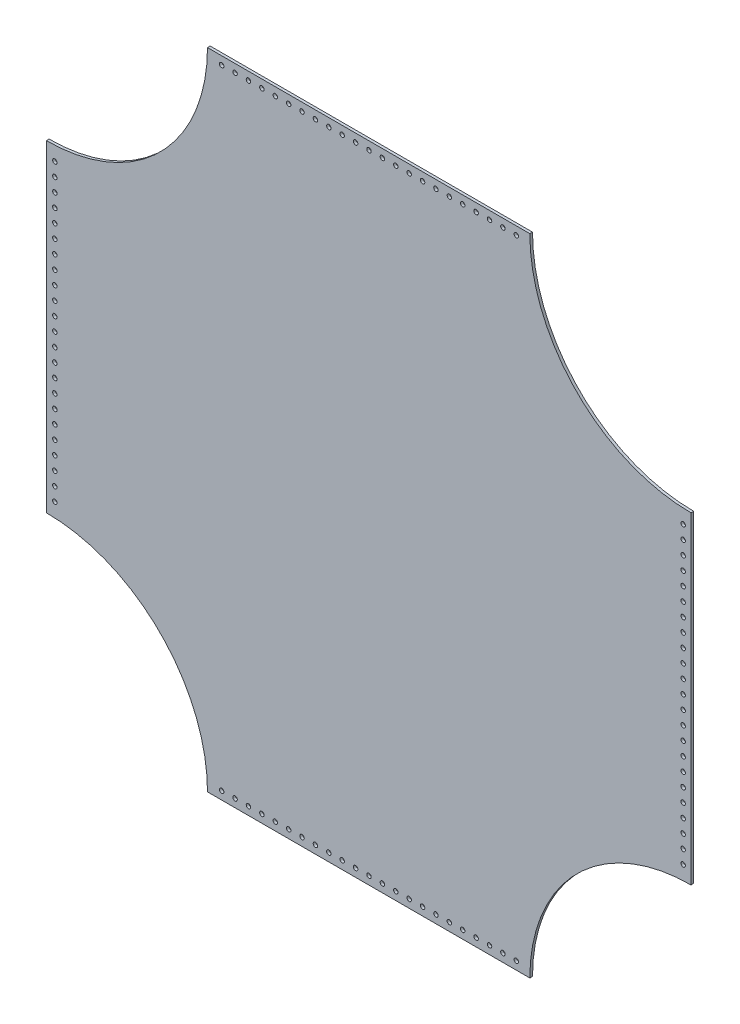
from build123d import *

# Parameters (mm, degrees)
BOSS_EXTRUDE1_DEPTH = 3
SKETCH2_R           = 2.5
CUT_EXTRUDE1_DEPTH  = 3
CIRPATTERN1_COUNT   = 4


with BuildPart() as part:
    # Sketch1 → Boss-Extrude1 (new body)
    with BuildSketch(Plane.XY):
        with BuildLine():
            Line((-361, 180.5), (-361, -180.5))
            ThreePointArc((-361, -180.5), (-233.367225996, -233.367225996), (-180.5, -361))
            Line((-180.5, -361), (180.5, -361))
            ThreePointArc((180.5, -361), (233.367225996, -233.367225996), (361, -180.5))
            Line((361, -180.5), (361, 180.5))
            ThreePointArc((361, 180.5), (233.367225996, 233.367225996), (180.5, 361))
            Line((180.5, 361), (-180.5, 361))
            ThreePointArc((-180.5, 361), (-233.367225996, 233.367225996), (-361, 180.5))
        make_face()
    extrude(amount=BOSS_EXTRUDE1_DEPTH)

    # Sketch2 → Cut-Extrude1 (cut)
    with BuildSketch(Plane.XY.offset(3)):
        with Locations((-351.5, 165)):
            Circle(SKETCH2_R)
        with Locations((-351.5, 150)):
            Circle(SKETCH2_R)
        with Locations((-351.5, 135)):
            Circle(SKETCH2_R)
        with Locations((-351.5, 120)):
            Circle(SKETCH2_R)
        with Locations((-351.5, 105)):
            Circle(SKETCH2_R)
        with Locations((-351.5, 90)):
            Circle(SKETCH2_R)
        with Locations((-351.5, 75)):
            Circle(SKETCH2_R)
        with Locations((-351.5, 60)):
            Circle(SKETCH2_R)
        with Locations((-351.5, 45)):
            Circle(SKETCH2_R)
        with Locations((-351.5, 30)):
            Circle(SKETCH2_R)
        with Locations((-351.5, 15)):
            Circle(SKETCH2_R)
        with Locations((-351.5, 0)):
            Circle(SKETCH2_R)
        with Locations((-351.5, -15)):
            Circle(SKETCH2_R)
        with Locations((-351.5, -30)):
            Circle(SKETCH2_R)
        with Locations((-351.5, -165)):
            Circle(SKETCH2_R)
        with Locations((-351.5, -150)):
            Circle(SKETCH2_R)
        with Locations((-351.5, -135)):
            Circle(SKETCH2_R)
        with Locations((-351.5, -120)):
            Circle(SKETCH2_R)
        with Locations((-351.5, -45)):
            Circle(SKETCH2_R)
        with Locations((-351.5, -60)):
            Circle(SKETCH2_R)
        with Locations((-351.5, -75)):
            Circle(SKETCH2_R)
        with Locations((-351.5, -90)):
            Circle(SKETCH2_R)
        with Locations((-351.5, -105)):
            Circle(SKETCH2_R)
    cut_extrude1 = extrude(amount=-CUT_EXTRUDE1_DEPTH, mode=Mode.SUBTRACT)

    # CirPattern1: Cut-Extrude1 ×4 about axis
    cirpattern1_axis = Axis((0.379323616, 0, 0), (0, 0, 1))
    for i in range(1, CIRPATTERN1_COUNT):
        add(cut_extrude1.rotate(cirpattern1_axis, i * 360 / CIRPATTERN1_COUNT), mode=Mode.SUBTRACT)


solid = part.part
